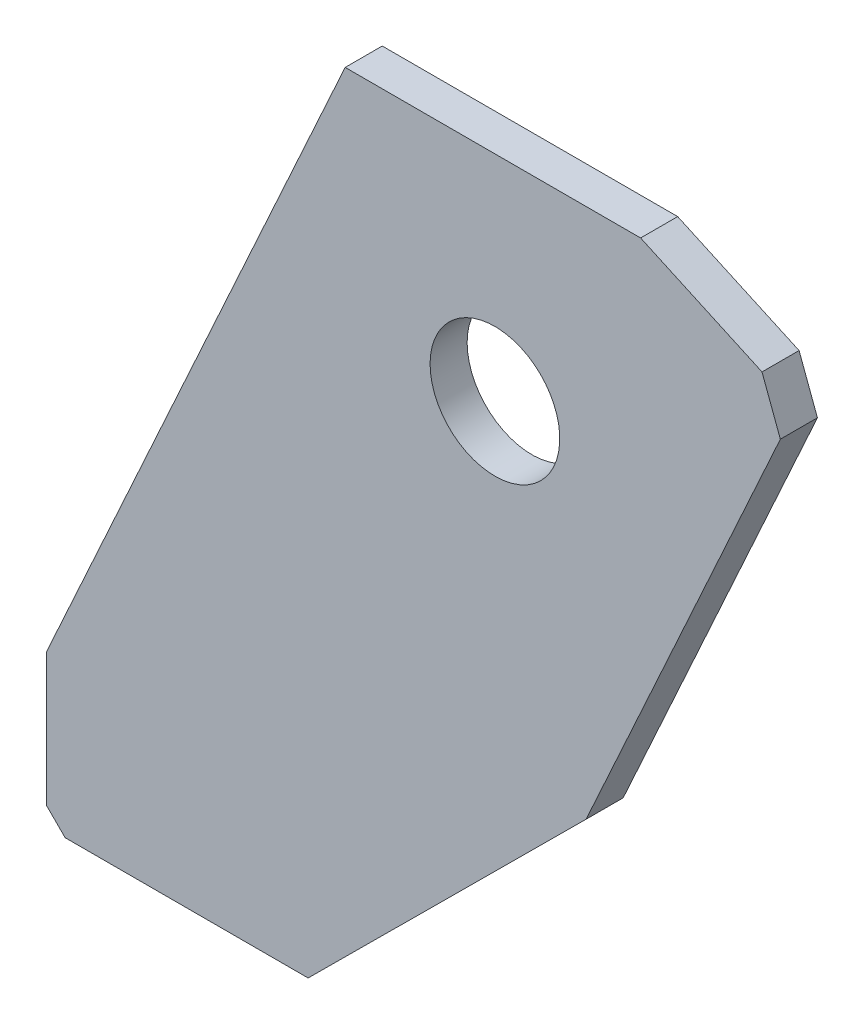
from build123d import *

# Parameters (mm, degrees)
BOSS_EXTRUDE1_DEPTH = 10
CUT_EXTRUDE1_DEPTH  = 10
SKETCH3_R           = 17.5
CUT_EXTRUDE2_DEPTH  = 10


with BuildPart() as part:
    # Sketch1 → Boss-Extrude1 (new body)
    with BuildSketch(Plane.XY):
        Polygon((-162.542296849, -28.60707156), (-158.542296849, -28.60707156), (-158.542296849, -64.60707156), (-153.542296849, -69.60707156), (-87.954361389, -69.60707156), (-12.936677956, 5.002214078), (39.495227245, 120.053529566), (34.542546963, 133.300074701), (1.783941212, 148.229031436), (3.442714182, 151.86887652), (-80.294668817, 151.86887652), align=None)
    extrude(amount=BOSS_EXTRUDE1_DEPTH)

    # Sketch2 → Cut-Extrude1 (cut)
    with BuildSketch(Plane.XY.offset(10)):
        Polygon((1.783941212, 148.229031436), (-77.953441788, 148.229031436), (-158.542296849, -28.60707156), (-177.628261738, -46.12321945), (-258.764859666, -56.78409298), (-118.247869319, 215.351823208), (19.357832203, 157.605676218), align=None)
    extrude(amount=-CUT_EXTRUDE1_DEPTH, mode=Mode.SUBTRACT)

    # Sketch3 → Cut-Extrude2 (cut)
    with BuildSketch(Plane(origin=(0, 0, 0), x_dir=(-1, 0, 0), z_dir=(0, 0, -1))):
        with Locations((37.542296849, 90.39292844)):
            Circle(SKETCH3_R)
    extrude(amount=-CUT_EXTRUDE2_DEPTH, mode=Mode.SUBTRACT)


solid = part.part
